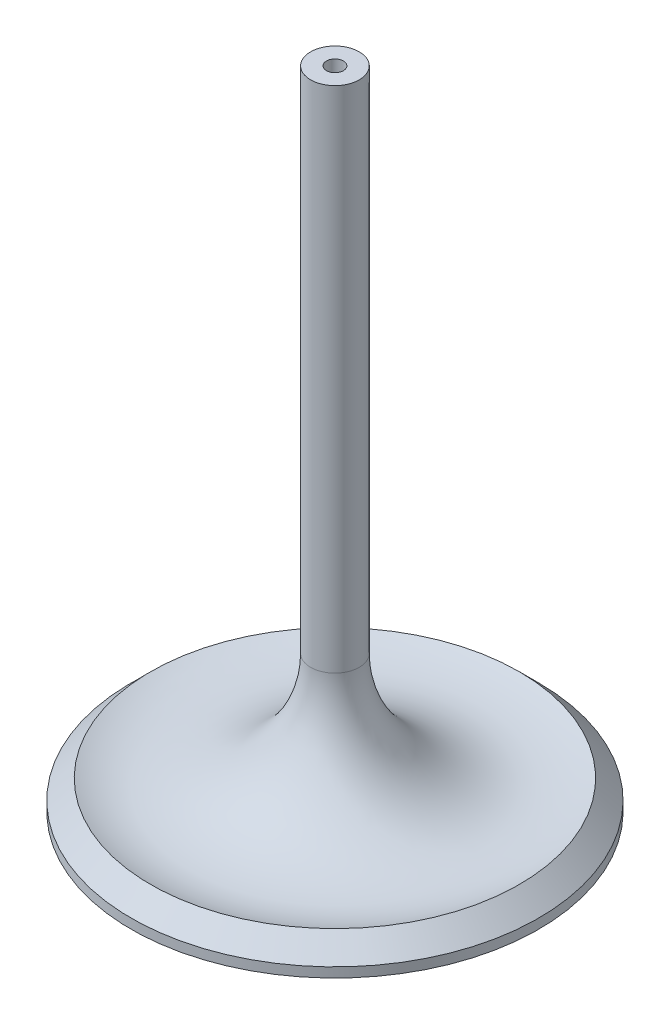
from build123d import *

# Parameters (mm, degrees)
SKETCH2_R          = 14.510934511
CUT_EXTRUDE1_DEPTH = 1.2
SKETCH3_R          = 1.106535356
CUT_EXTRUDE2_DEPTH = 95.2
SKETCH4_R          = 9.062497532
CUT_EXTRUDE3_DEPTH = 1


with BuildPart() as part:
    # Sketch1 → Revolve1 (revolve)
    with BuildSketch(Plane.XY, mode=Mode.PRIVATE) as revolve1_sk:
        with BuildLine():
            Line((0, 0), (0, 84.55))
            Line((0, 84.55), (3.18, 84.55))
            Line((3.18, 84.55), (3.18, 17.954698654))
            ThreePointArc((3.18, 17.954698654), (9.896609701, 5.315721242), (24.13, 3.81))
            Line((24.13, 3.81), (26.67, 1.27))
            Line((26.67, 1.27), (26.67, 0))
            Line((26.67, 0), (0, 0))
        make_face()
    revolve(revolve1_sk.sketch.rotate(Axis((0, 0, 0), (0, 1, 0)), 90), axis=Axis((0, 0, 0), (0, 1, 0)))

    # Sketch2 → Cut-Extrude1 (cut)
    with BuildSketch(Plane.XZ):
        with Locations(Location((0, 0, 0), (0, 0, 270))):
            Circle(SKETCH2_R)
    extrude(amount=-CUT_EXTRUDE1_DEPTH, mode=Mode.SUBTRACT)

    # Sketch3 → Cut-Extrude2 (cut)
    with BuildSketch(Plane(origin=(0, 84.55, 0), x_dir=(1, 0, 0), z_dir=(0, 1, 0))):
        with Locations(Location((0, 0, 0), (0, 0, 270))):
            Circle(SKETCH3_R)
    extrude(amount=-CUT_EXTRUDE2_DEPTH, mode=Mode.SUBTRACT)

    # Sketch4 → Cut-Extrude3 (cut)
    with BuildSketch(Plane.XZ.offset(-1.2)):
        with Locations(Location((0, 0, 0), (0, 0, 270))):
            Circle(SKETCH4_R)
    extrude(amount=-CUT_EXTRUDE3_DEPTH, mode=Mode.SUBTRACT)


solid = part.part
